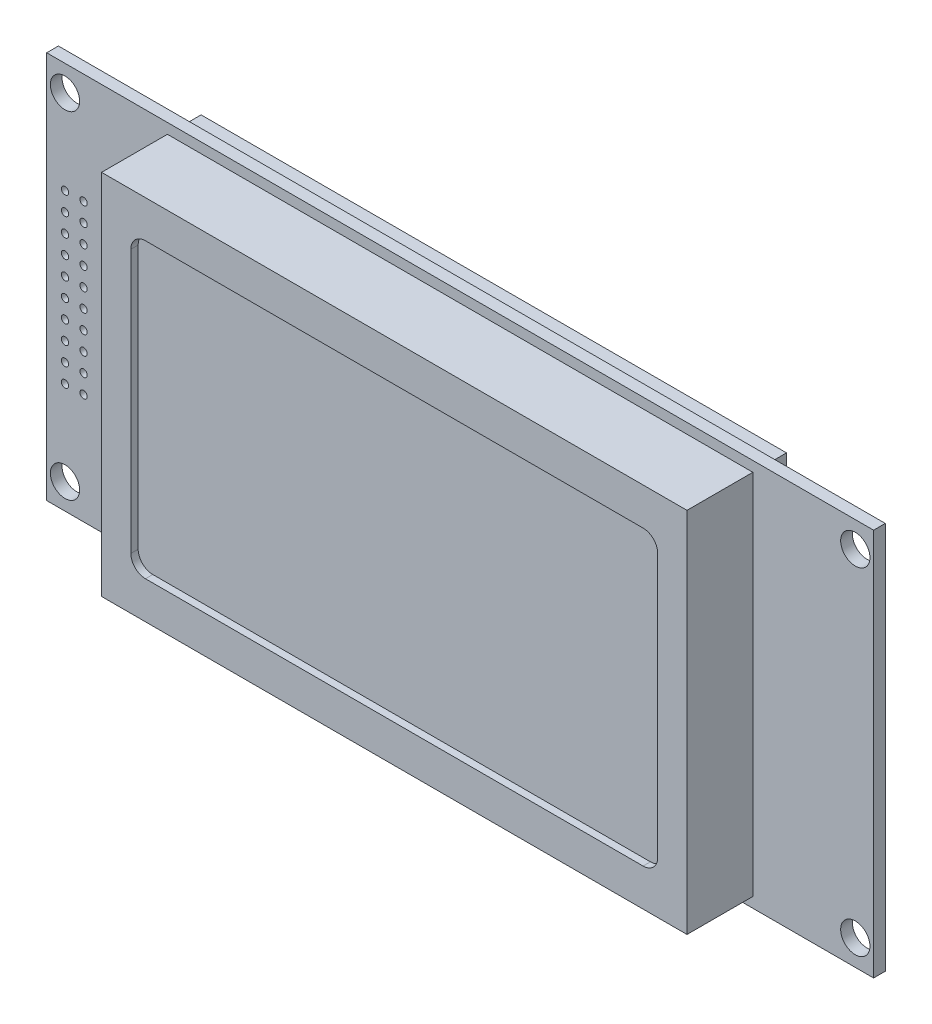
from build123d import *

# Parameters (mm, degrees)
ESQUISSE1_W             = 113
ESQUISSE1_H             = 53
ESQUISSE1_R             = 2
ESQUISSE1_R_2           = 0.5
BOSS_EXTRU_1_DEPTH      = 1.6
ESQUISSE2_W             = 80
ESQUISSE2_H             = 50.2
BOSS_EXTRU_2_DEPTH      = 9
ENL_V_MAT_EXTRU_1_DEPTH = 1
ESQUISSE6_W             = 80
ESQUISSE6_H             = 2.428445289
ESQUISSE6_H_2           = 1.774946784
BOSS_EXTRU_3_DEPTH      = 3


with BuildPart() as part:
    # Esquisse1 → Boss.-Extru.1 (new body)
    with BuildSketch(Plane.XY):
        Rectangle(ESQUISSE1_W, ESQUISSE1_H)
        with Locations((-54, 23)):
            Circle(ESQUISSE1_R, mode=Mode.SUBTRACT)
        with Locations((-54, -23)):
            Circle(ESQUISSE1_R, mode=Mode.SUBTRACT)
        with Locations(Location((54, -23, 0), (0, 0, 180))):
            Circle(ESQUISSE1_R, mode=Mode.SUBTRACT)
        with Locations(Location((54, 23, 0), (0, 0, 180))):
            Circle(ESQUISSE1_R, mode=Mode.SUBTRACT)
        with Locations((-54, 11.43)):
            Circle(ESQUISSE1_R_2, mode=Mode.SUBTRACT)
        with Locations((-51.46, 11.43)):
            Circle(ESQUISSE1_R_2, mode=Mode.SUBTRACT)
        with Locations((-51.46, 8.89)):
            Circle(ESQUISSE1_R_2, mode=Mode.SUBTRACT)
        with Locations((-51.46, 6.35)):
            Circle(ESQUISSE1_R_2, mode=Mode.SUBTRACT)
        with Locations((-51.46, 3.81)):
            Circle(ESQUISSE1_R_2, mode=Mode.SUBTRACT)
        with Locations((-51.46, 1.27)):
            Circle(ESQUISSE1_R_2, mode=Mode.SUBTRACT)
        with Locations((-51.46, -1.27)):
            Circle(ESQUISSE1_R_2, mode=Mode.SUBTRACT)
        with Locations((-51.46, -3.81)):
            Circle(ESQUISSE1_R_2, mode=Mode.SUBTRACT)
        with Locations((-51.46, -6.35)):
            Circle(ESQUISSE1_R_2, mode=Mode.SUBTRACT)
        with Locations((-51.46, -8.89)):
            Circle(ESQUISSE1_R_2, mode=Mode.SUBTRACT)
        with Locations((-51.46, -11.43)):
            Circle(ESQUISSE1_R_2, mode=Mode.SUBTRACT)
        with Locations((-54, 8.89)):
            Circle(ESQUISSE1_R_2, mode=Mode.SUBTRACT)
        with Locations((-54, 6.35)):
            Circle(ESQUISSE1_R_2, mode=Mode.SUBTRACT)
        with Locations((-54, 3.81)):
            Circle(ESQUISSE1_R_2, mode=Mode.SUBTRACT)
        with Locations((-54, 1.27)):
            Circle(ESQUISSE1_R_2, mode=Mode.SUBTRACT)
        with Locations((-54, -1.27)):
            Circle(ESQUISSE1_R_2, mode=Mode.SUBTRACT)
        with Locations((-54, -3.81)):
            Circle(ESQUISSE1_R_2, mode=Mode.SUBTRACT)
        with Locations((-54, -6.35)):
            Circle(ESQUISSE1_R_2, mode=Mode.SUBTRACT)
        with Locations((-54, -8.89)):
            Circle(ESQUISSE1_R_2, mode=Mode.SUBTRACT)
        with Locations((-54, -11.43)):
            Circle(ESQUISSE1_R_2, mode=Mode.SUBTRACT)
    extrude(amount=BOSS_EXTRU_1_DEPTH)

    # Esquisse2 → Boss.-Extru.2 (add)
    with BuildSketch(Plane.XY.offset(1.6)):
        Rectangle(ESQUISSE2_W, ESQUISSE2_H)
    extrude(amount=BOSS_EXTRU_2_DEPTH)

    # Esquisse4 → Enlèv. mat.-Extru.1 (cut)
    with BuildSketch(Plane.XY.offset(10.6)):
        with BuildLine():
            Line((34, -20), (-34, -20))
            ThreePointArc((-34, -20), (-35.414213562, -19.414213562), (-36, -18))
            Line((-36, -18), (-36, 18))
            ThreePointArc((-36, 18), (-35.414213562, 19.414213562), (-34, 20))
            Line((-34, 20), (34, 20))
            ThreePointArc((34, 20), (35.414213562, 19.414213562), (36, 18))
            Line((36, 18), (36, -18))
            ThreePointArc((36, -18), (35.414213562, -19.414213562), (34, -20))
        make_face()
    extrude(amount=-ENL_V_MAT_EXTRU_1_DEPTH, mode=Mode.SUBTRACT)

    # Esquisse6 → Boss.-Extru.3 (add)
    with BuildSketch(Plane(origin=(0, 0, 0), x_dir=(-1, 0, 0), z_dir=(0, 0, -1))):
        with Locations((0, 23.885777356)):
            Rectangle(ESQUISSE6_W, ESQUISSE6_H)
        with Locations((0, -24.212526608)):
            Rectangle(ESQUISSE6_W, ESQUISSE6_H_2)
    extrude(amount=BOSS_EXTRU_3_DEPTH)


solid = part.part
